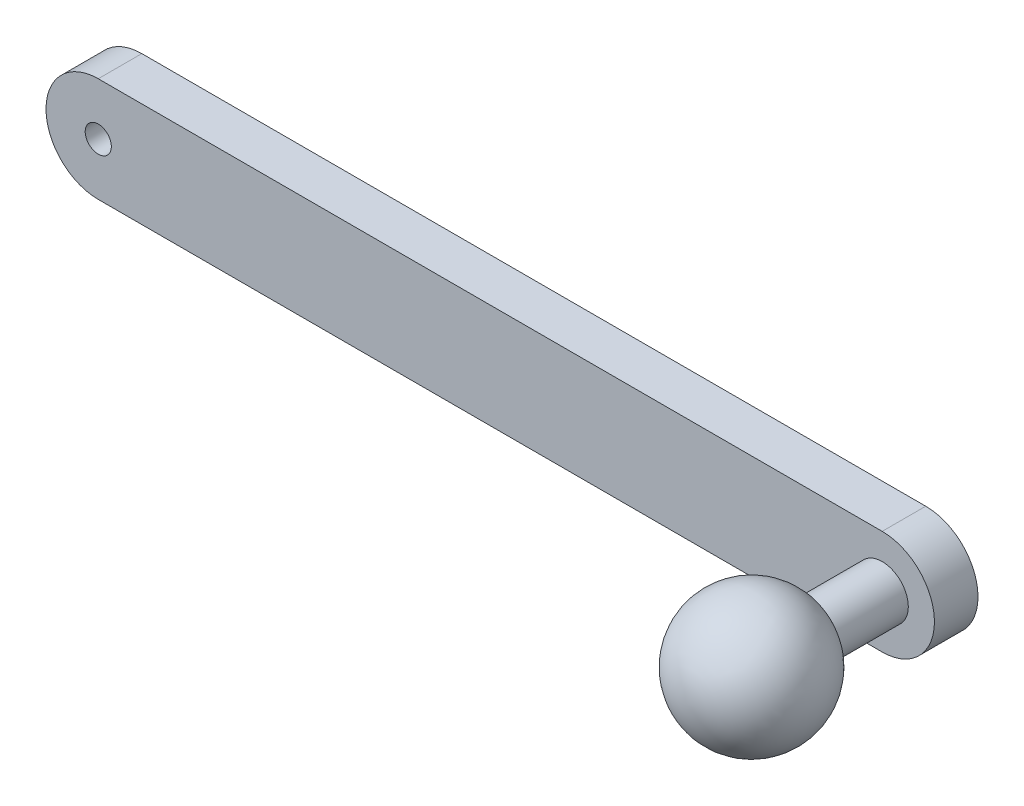
from build123d import *

# Parameters (mm, degrees)
SKETCH1_R           = 1.5
BOSS_EXTRUDE1_DEPTH = 5
FILLET3_R           = 1
BOSS_EXTRUDE2_START = -5
SKETCH2_R           = 3
BOSS_EXTRUDE2_DEPTH = 20


with BuildPart() as part:
    # Sketch1 → Boss-Extrude1 (new body)
    with BuildSketch(Plane.XY):
        with BuildLine():
            ThreePointArc((0, 6), (-6, 0), (0, -6))
            Line((0, -6), (90, -6))
            ThreePointArc((90, -6), (96, 0), (90, 6))
            Line((90, 6), (0, 6))
        make_face()
        Circle(SKETCH1_R, mode=Mode.SUBTRACT)
        with Locations((90, 0)):
            Circle(SKETCH1_R, mode=Mode.SUBTRACT)
    extrude(amount=BOSS_EXTRUDE1_DEPTH)

    # Fillet3
    fillet3_edges = [part.edges().sort_by_distance(p)[0] for p in [
        (88.5, 0, 0),
    ]]
    fillet(fillet3_edges, radius=FILLET3_R)

    # Sketch2 → Boss-Extrude2 (add)
    with BuildSketch(Plane.XY.offset(5).offset(BOSS_EXTRUDE2_START)):
        with Locations((90, 0)):
            Circle(SKETCH2_R)
    extrude(amount=BOSS_EXTRUDE2_DEPTH)

    # Sketch3 → Revolve1 (revolve)
    with BuildSketch(Plane.XY.offset(20)):
        with BuildLine():
            Line((82.5, 0), (97.5, 0))
            ThreePointArc((97.5, 0), (90, 7.5), (82.5, 0))
        make_face()
    revolve(axis=Axis((90, 0, 20), (1, 0, 0)))


solid = part.part
